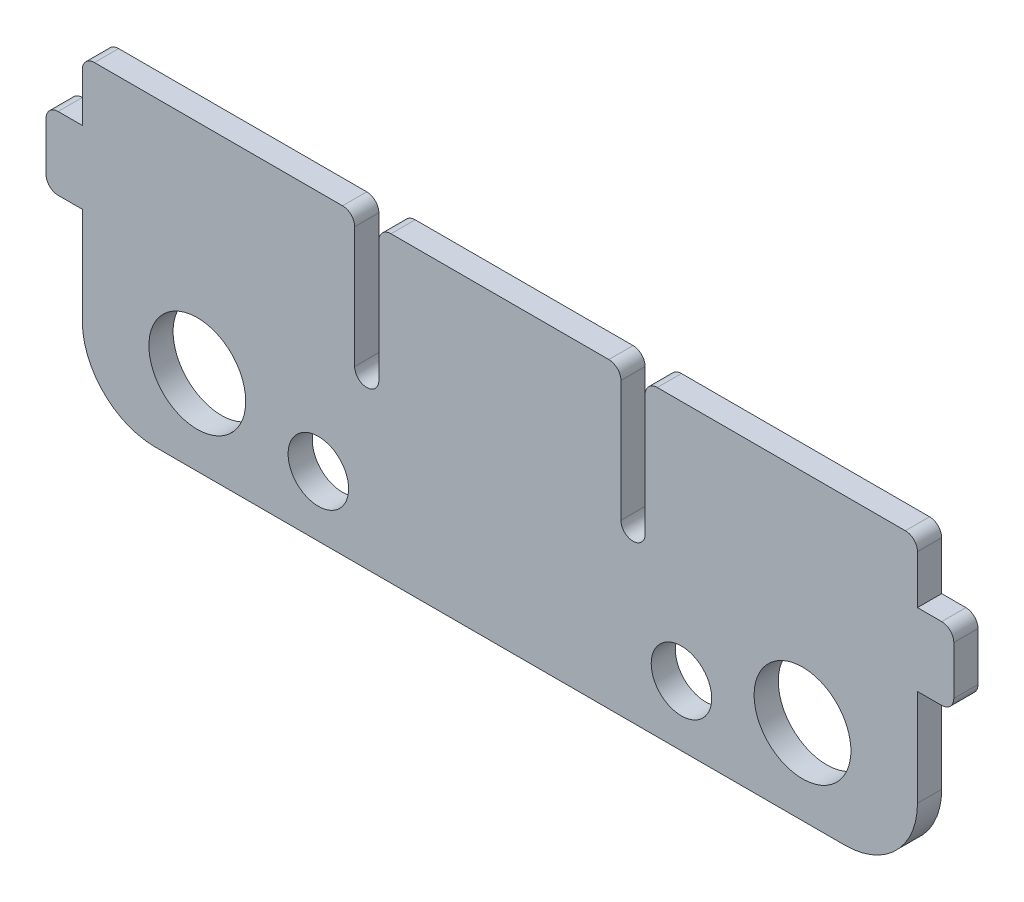
from build123d import *

# Parameters (mm, degrees)
ESBO_O1_R                = 4
ESBO_O1_R_2              = 2.5
RESSALTO_EXTRUS_O1_DEPTH = 2


with BuildPart() as part:
    # Esboço1 → Ressalto-extrusão1 (new body)
    with BuildSketch(Plane.XY):
        with BuildLine():
            Line((-34.5, 1.5), (-34.5, -6.5))
            ThreePointArc((-34.5, -6.5), (-32.742640687, -10.742640687), (-28.5, -12.5))
            Line((-28.5, -12.5), (28.5, -12.5))
            ThreePointArc((28.5, -12.5), (32.742640687, -10.742640687), (34.5, -6.5))
            Line((34.5, -6.5), (34.5, 1.5))
            Line((34.5, 1.5), (36.5, 1.5))
            ThreePointArc((36.5, 1.5), (37.207106781, 1.792893219), (37.5, 2.5))
            Line((37.5, 2.5), (37.5, 6.5))
            ThreePointArc((37.5, 6.5), (37.207106781, 7.207106781), (36.5, 7.5))
            Line((36.5, 7.5), (34.5, 7.5))
            Line((34.5, 7.5), (34.5, 11.5))
            ThreePointArc((34.5, 11.5), (34.207106781, 12.207106781), (33.5, 12.5))
            Line((33.5, 12.5), (13, 12.5))
            ThreePointArc((13, 12.5), (12.292893219, 12.207106781), (12, 11.5))
            Line((12, 11.5), (12, 1.5))
            ThreePointArc((12, 1.5), (11, 0.5), (10, 1.5))
            Line((10, 1.5), (10, 11.5))
            ThreePointArc((10, 11.5), (9.707106781, 12.207106781), (9, 12.5))
            Line((9, 12.5), (-9, 12.5))
            ThreePointArc((-9, 12.5), (-9.707106781, 12.207106781), (-10, 11.5))
            Line((-10, 11.5), (-10, 1.5))
            ThreePointArc((-10, 1.5), (-11, 0.5), (-12, 1.5))
            Line((-12, 1.5), (-12, 11.5))
            ThreePointArc((-12, 11.5), (-12.292893219, 12.207106781), (-13, 12.5))
            Line((-13, 12.5), (-33.5, 12.5))
            ThreePointArc((-33.5, 12.5), (-34.207106781, 12.207106781), (-34.5, 11.5))
            Line((-34.5, 11.5), (-34.5, 7.5))
            Line((-34.5, 7.5), (-36.5, 7.5))
            ThreePointArc((-36.5, 7.5), (-37.207106781, 7.207106781), (-37.5, 6.5))
            Line((-37.5, 6.5), (-37.5, 2.5))
            ThreePointArc((-37.5, 2.5), (-37.207106781, 1.792893219), (-36.5, 1.5))
            Line((-36.5, 1.5), (-34.5, 1.5))
        make_face()
        with Locations((-25, -5.5)):
            Circle(ESBO_O1_R, mode=Mode.SUBTRACT)
        with Locations((-15, -7.5)):
            Circle(ESBO_O1_R_2, mode=Mode.SUBTRACT)
        with Locations(Location((15, -7.5, 0), (0, 0, 180))):
            Circle(ESBO_O1_R_2, mode=Mode.SUBTRACT)
        with Locations(Location((25, -5.5, 0), (0, 0, 180))):
            Circle(ESBO_O1_R, mode=Mode.SUBTRACT)
    extrude(amount=RESSALTO_EXTRUS_O1_DEPTH)


solid = part.part
